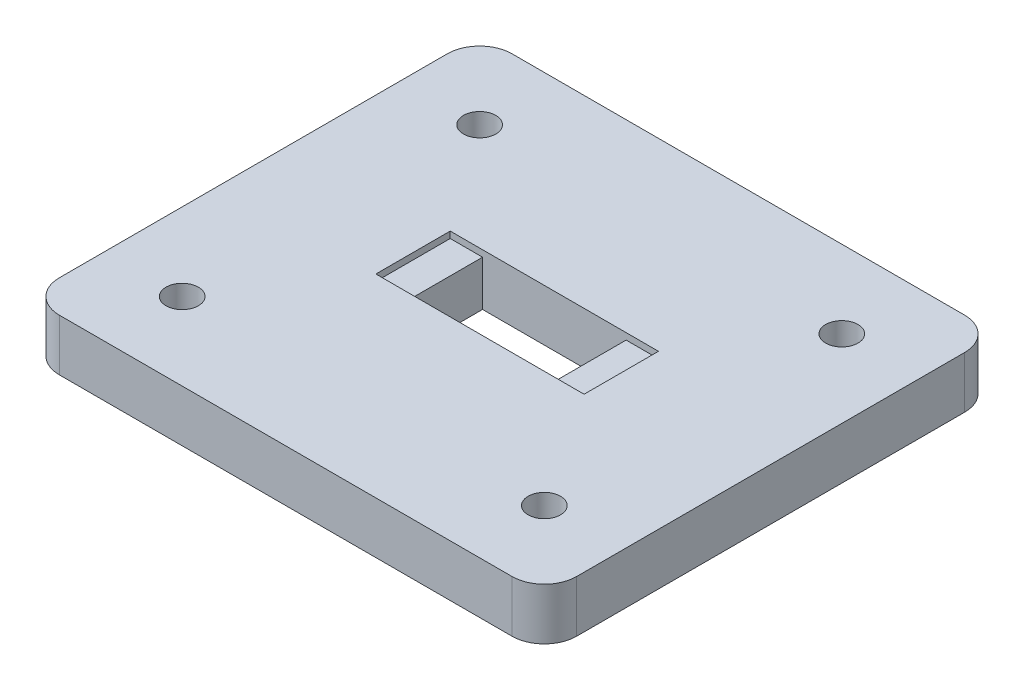
from build123d import *

# Parameters (mm, degrees)
SKETCH1_W               = 80
SKETCH1_H               = 70
BOSS_EXTRUDE1_DEPTH     = 8
FILLET1_R               = 5
CUT_EXTRUDE1_DEPTH      = 54.749418602
CUT_EXTRUDE1_DEPTH_BACK = 18
SKETCH2_W               = 22.2
SKETCH2_H               = 11.5
CUT_EXTRUDE2_DEPTH      = 54.749418602
CUT_EXTRUDE2_DEPTH_BACK = 1
SKETCH2_3_W             = 5
SKETCH2_3_H             = 11.5
SKETCH3_R               = 2.5
CUT_EXTRUDE3_DEPTH      = 31


with BuildPart() as part:
    # Sketch1 → Boss-Extrude1 (new body)
    with BuildSketch(Plane(origin=(0, 0, 0), x_dir=(1, 0, 0), z_dir=(0, 1, 0))):
        Rectangle(SKETCH1_W, SKETCH1_H)
    extrude(amount=BOSS_EXTRUDE1_DEPTH)

    # Fillet1
    fillet1_edges = [part.edges().sort_by_distance(p)[0] for p in [
        (40, 4, 35),
        (-40, 4, 35),
        (-40, 4, -35),
        (40, 4, -35),
    ]]
    fillet(fillet1_edges, radius=FILLET1_R)

    # Sketch2 → Cut-Extrude1 (cut, two sides: drawn at the far end of the back side and taken through both)
    with BuildSketch(Plane(origin=(0, 8, 0), x_dir=(1, 0, 0), z_dir=(0, 1, 0)).offset(-CUT_EXTRUDE1_DEPTH_BACK)):
        with Locations((0.065960995, 0.732397703)):
            Rectangle(SKETCH2_W, SKETCH2_H)
    extrude(amount=CUT_EXTRUDE1_DEPTH + CUT_EXTRUDE1_DEPTH_BACK, mode=Mode.SUBTRACT)

    # Sketch2<3> → Cut-Extrude2 (cut, two sides: drawn at the far end of the back side and taken through both)
    with BuildSketch(Plane(origin=(0, 8, 0), x_dir=(1, 0, 0), z_dir=(0, 1, 0)).offset(-CUT_EXTRUDE2_DEPTH_BACK)):
        with Locations((13.665960995, 0.732397703)):
            Rectangle(SKETCH2_3_W, SKETCH2_3_H)
        with Locations((-13.534039005, 0.732397703)):
            Rectangle(SKETCH2_3_W, SKETCH2_3_H)
    extrude(amount=CUT_EXTRUDE2_DEPTH + CUT_EXTRUDE2_DEPTH_BACK, mode=Mode.SUBTRACT)

    # Sketch3 → Cut-Extrude3 (cut)
    with BuildSketch(Plane(origin=(0, 8, 0), x_dir=(1, 0, 0), z_dir=(0, 1, 0))):
        with Locations((28, 23)):
            Circle(SKETCH3_R)
        with Locations((28, -23)):
            Circle(SKETCH3_R)
        with Locations((-28, 23)):
            Circle(SKETCH3_R)
        with Locations((-28, -23)):
            Circle(SKETCH3_R)
    extrude(amount=-CUT_EXTRUDE3_DEPTH, mode=Mode.SUBTRACT)


solid = part.part
